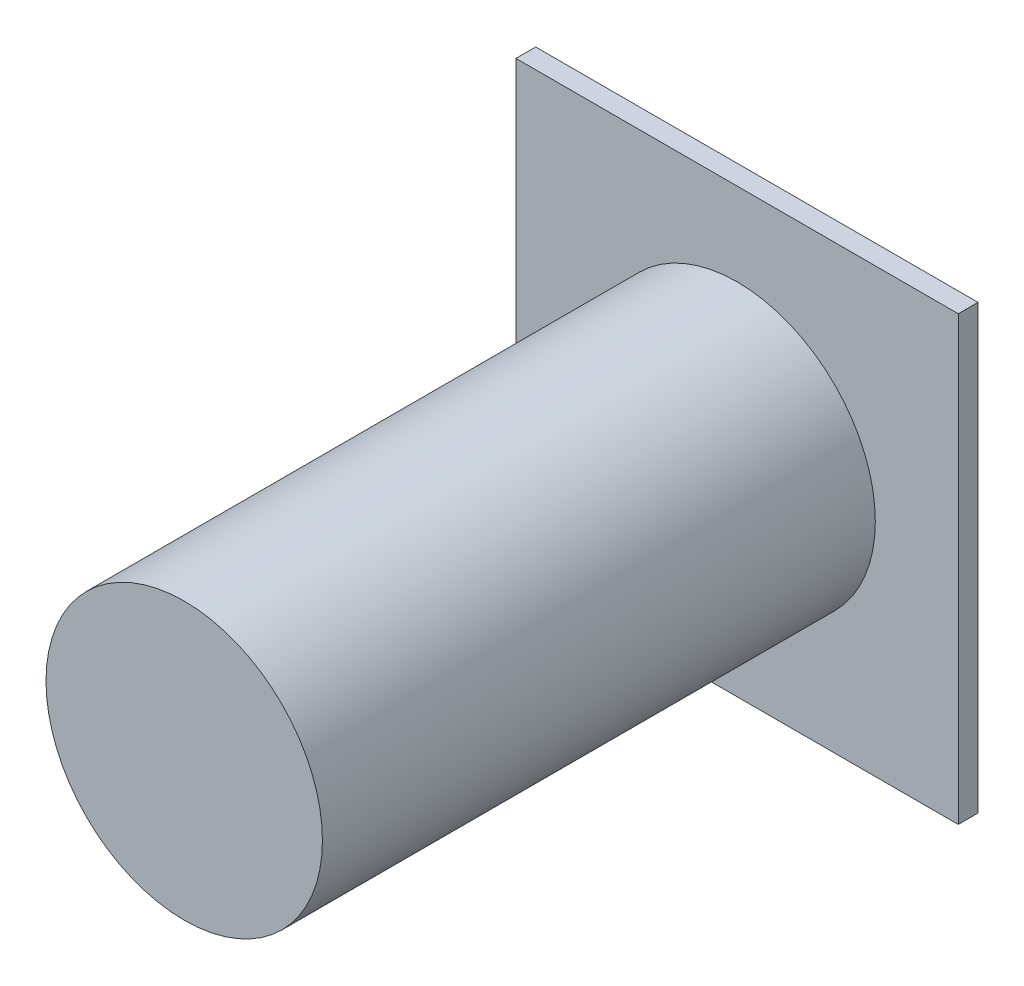
from build123d import *

# Parameters (mm, degrees)
SKETCH1_W           = 56
SKETCH1_H           = 56
BOSS_EXTRUDE1_DEPTH = 2.5
SKETCH2_R           = 17.5
BOSS_EXTRUDE2_DEPTH = 70


with BuildPart() as part:
    # Sketch1 → Boss-Extrude1 (new body)
    with BuildSketch(Plane.XY):
        Rectangle(SKETCH1_W, SKETCH1_H)
    extrude(amount=BOSS_EXTRUDE1_DEPTH)

    # Sketch2 → Boss-Extrude2 (add)
    with BuildSketch(Plane.XY.offset(2.5)):
        Circle(SKETCH2_R)
    extrude(amount=BOSS_EXTRUDE2_DEPTH)


solid = part.part
